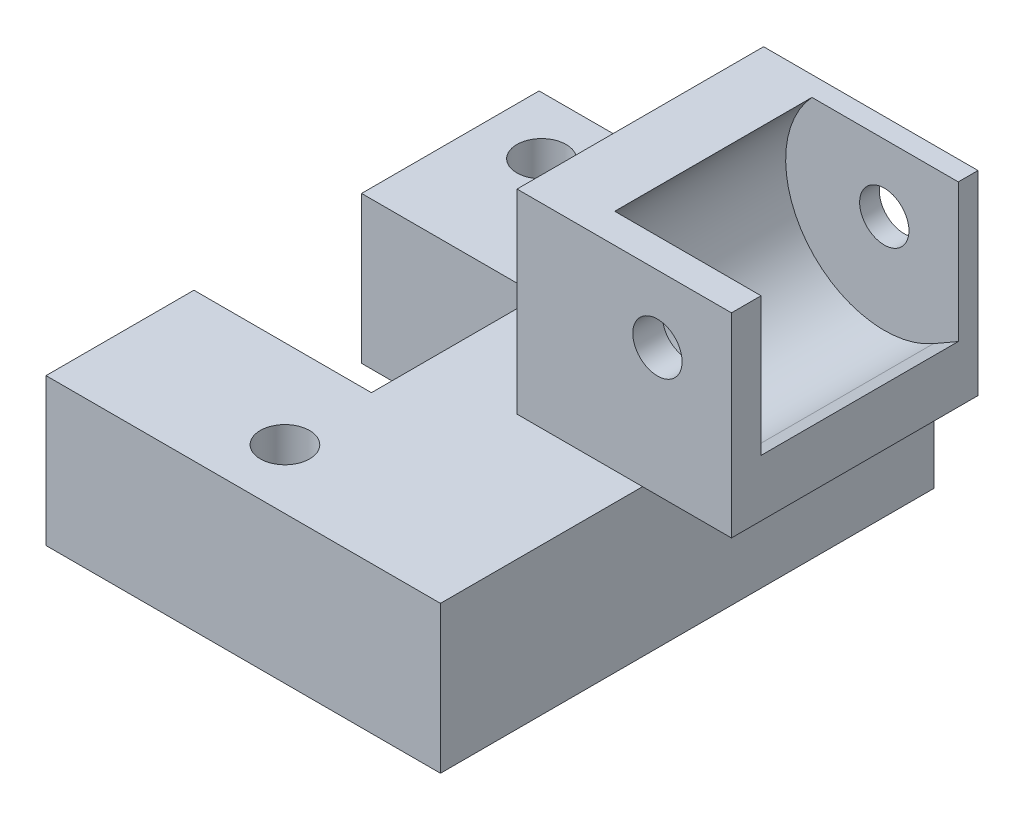
from build123d import *

# Parameters (mm, degrees)
BOSS_EXTRUDE1_DEPTH = 27.94
SKETCH2_R           = 3.175
BOSS_EXTRUDE2_DEPTH = 2.54
BOSS_EXTRUDE3_START = 3.81
SKETCH3_W           = 27.611756562
SKETCH3_H           = 25.107614127
SKETCH3_R           = 3.175
BOSS_EXTRUDE3_DEPTH = 3.81
SKETCH4_R           = 3.175
BOSS_EXTRUDE4_DEPTH = 18.954575182
SKETCH5_W           = 22.86
SKETCH5_H           = 21.59
CUT_EXTRUDE1_DEPTH  = 564.927995542


with BuildPart() as part:
    # Sketch1 → Boss-Extrude1 (new body)
    with BuildSketch(Plane.XY):
        with BuildLine():
            Line((-518.959059009, 348.633589309), (-527.727560082, 348.633589309))
            Line((-527.727560082, 348.633589309), (-527.727560082, 323.525975182))
            Line((-527.727560082, 323.525975182), (-500.11580352, 323.525975182))
            Line((-500.11580352, 323.525975182), (-500.11580352, 330.828951218))
            Line((-500.11580352, 330.828951218), (-503.31589155, 328.989459324))
            ThreePointArc((-503.31589155, 328.989459324), (-505.910190066, 327.86159111), (-508.689794246, 327.335975182))
            ThreePointArc((-508.689794246, 327.335975182), (-520.655570716, 333.67086151), (-520.107560082, 347.198990562))
            ThreePointArc((-520.107560082, 347.198990562), (-519.559291988, 347.937090778), (-518.959059009, 348.633589309))
        make_face()
    extrude(amount=-BOSS_EXTRUDE1_DEPTH)

    # Sketch2 → Boss-Extrude2 (add)
    with BuildSketch(Plane(origin=(0, 0, -25.4), x_dir=(-1, 0, 0), z_dir=(0, 0, -1))):
        with BuildLine():
            Line((500.11580352, 330.828951218), (500.11580352, 348.633589309))
            Line((500.11580352, 348.633589309), (518.959059009, 348.633589309))
            ThreePointArc((518.959059009, 348.633589309), (519.579835197, 332.088638139), (503.31589155, 328.989459324))
            Line((503.31589155, 328.989459324), (500.11580352, 330.828951218))
        make_face()
        with Locations(Location((509.64503004, 340, 0), (0, 0, 180))):
            Circle(SKETCH2_R, mode=Mode.SUBTRACT)
    extrude(amount=BOSS_EXTRUDE2_DEPTH)

    # Sketch3 → Boss-Extrude3 (add)
    with BuildSketch(Plane.XY.offset(BOSS_EXTRUDE3_START)):
        with Locations((-513.921681801, 336.079782246)):
            Rectangle(SKETCH3_W, SKETCH3_H)
        with Locations((-509.64503004, 340)):
            Circle(SKETCH3_R, mode=Mode.SUBTRACT)
    extrude(amount=-BOSS_EXTRUDE3_DEPTH)

    # Sketch4 → Boss-Extrude4 (add)
    with BuildSketch(Plane(origin=(0, 323.525975182, 0), x_dir=(1, 0, 0), z_dir=(0, 1, 0))):
        Polygon((-562.359793246, 33.660212868), (-511.559810801, 33.702445144), (-511.559793246, -29.839787132), (-562.359793246, -29.839787132), align=None)
        with Locations(Location((-539.26913234, -22.159639935, 0), (0, 0, 270))):
            Circle(SKETCH4_R, mode=Mode.SUBTRACT)
        with Locations(Location((-554.645069674, 26.257511479, 0), (0, 0, 270))):
            Circle(SKETCH4_R, mode=Mode.SUBTRACT)
    extrude(amount=-BOSS_EXTRUDE4_DEPTH)

    # Sketch5 → Cut-Extrude1 (cut, through all)
    with BuildSketch(Plane(origin=(0, 323.525975182, 0), x_dir=(1, 0, 0), z_dir=(0, 1, 0))):
        with Locations((-550.929793246, 0.005212868)):
            Rectangle(SKETCH5_W, SKETCH5_H)
    extrude(amount=-CUT_EXTRUDE1_DEPTH, mode=Mode.SUBTRACT)


solid = part.part
